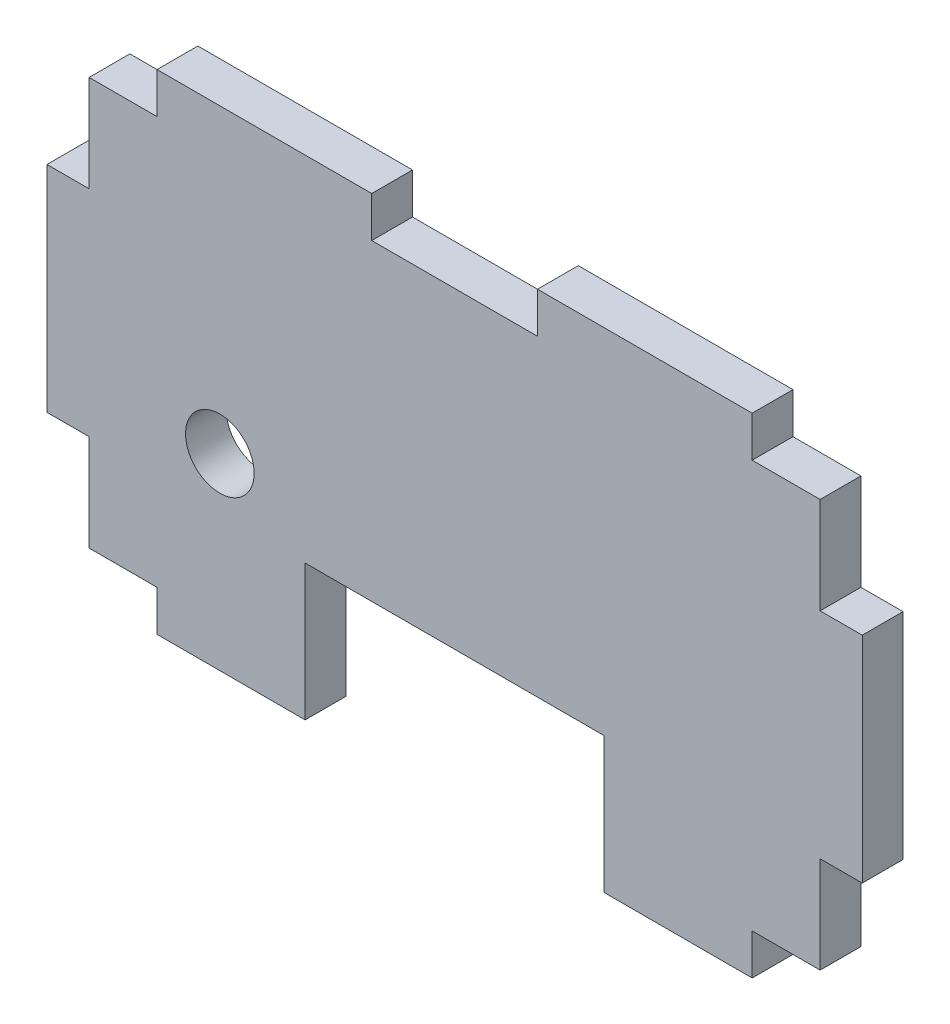
from build123d import *

# Parameters (mm, degrees)
SKETCH1_R           = 2.525
BOSS_EXTRUDE1_DEPTH = 3


with BuildPart() as part:
    # Sketch1 → Boss-Extrude1 (new body)
    with BuildSketch(Plane.XY):
        Polygon((5, 30), (0, 30), (0, 22.9), (-3.1, 22.9), (-3.1, 7.1), (0, 7.1), (0, 0), (5, 0), (5, -3), (15.9, -3), (15.9, 7), (37.9, 7), (37.9, -3), (48.8, -3), (48.8, 0), (53.8, 0), (53.8, 7.1), (56.9, 7.1), (56.9, 22.9), (53.8, 22.9), (53.8, 30), (48.8, 30), (48.8, 33), (33, 33), (33, 30), (20.8, 30), (20.8, 33), (5, 33), align=None)
        with Locations((9.620987069, 10.833243053)):
            Circle(SKETCH1_R, mode=Mode.SUBTRACT)
    extrude(amount=BOSS_EXTRUDE1_DEPTH)


solid = part.part
